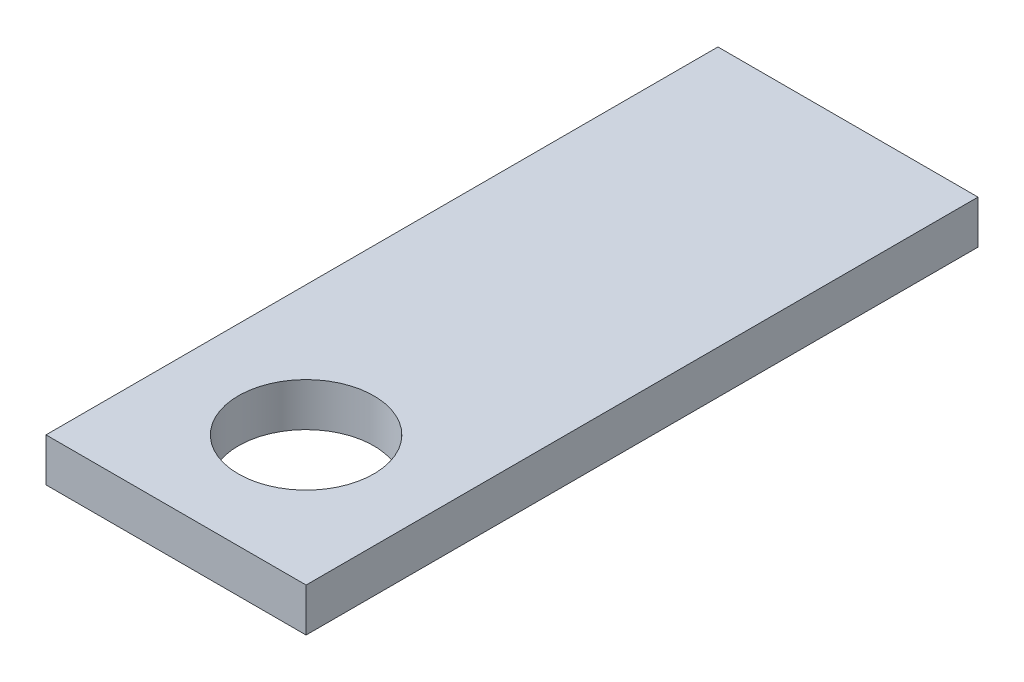
from build123d import *

# Parameters (mm, degrees)
SKETCH1_W                   = 38.1
SKETCH1_H                   = 6.35
EXTRUDE1_DEPTH              = 98.425
F_3_4_CLEARANCE_HOLE1_D     = 19.84248
F_3_4_CLEARANCE_HOLE1_DEPTH = 16.002
F_3_4_CLEARANCE_HOLE1_TIP   = 5.961282408


with BuildPart() as part:
    # Sketch1 → Extrude1 (new body)
    with BuildSketch(Plane.XY):
        Rectangle(SKETCH1_W, SKETCH1_H)
    extrude(amount=EXTRUDE1_DEPTH)

    # 3/4 Clearance Hole1
    with Locations(Plane(origin=(0, 3.175, 79.375), x_dir=(0, 0, 1), z_dir=(0, 1, 0))):
        with Locations((0, 0)):
            Hole(F_3_4_CLEARANCE_HOLE1_D / 2, depth=F_3_4_CLEARANCE_HOLE1_DEPTH)
            with Locations((0, 0, -(F_3_4_CLEARANCE_HOLE1_DEPTH + F_3_4_CLEARANCE_HOLE1_TIP / 2))):  # 118° drill point
                Cone(0, F_3_4_CLEARANCE_HOLE1_D / 2, F_3_4_CLEARANCE_HOLE1_TIP, mode=Mode.SUBTRACT)


solid = part.part
